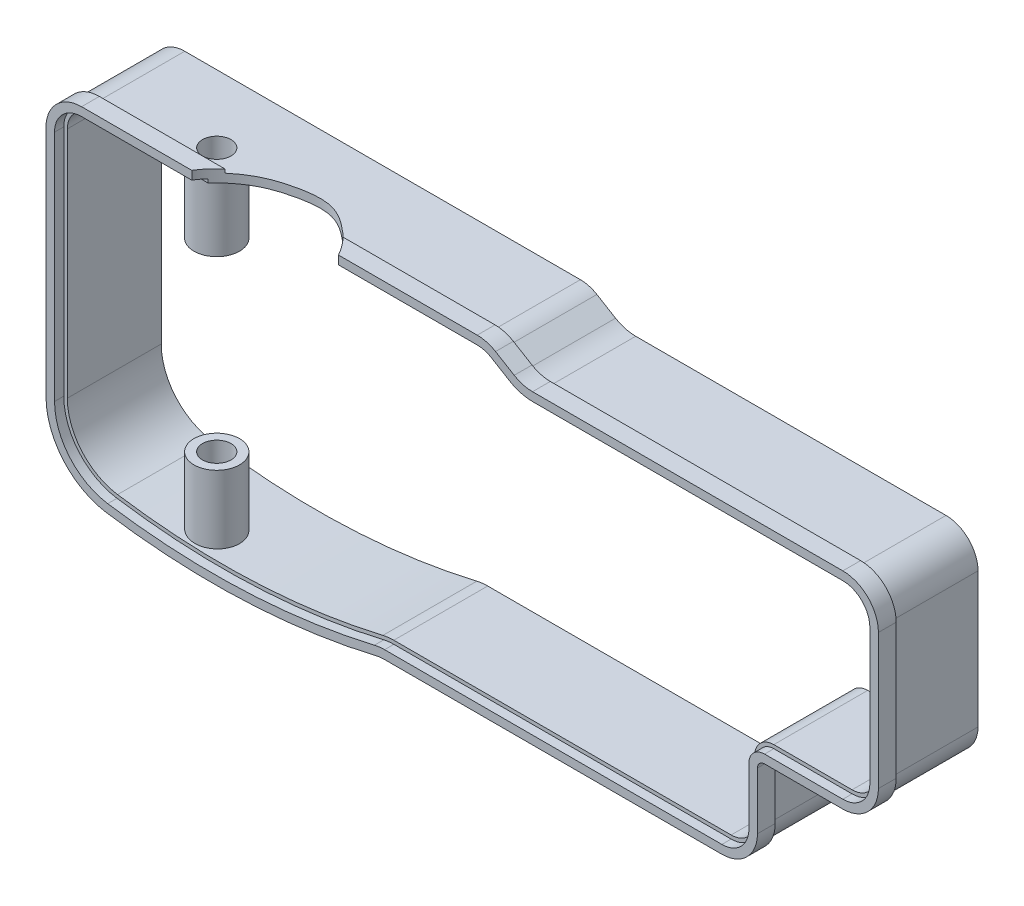
from build123d import *

# Parameters (mm, degrees)
EXTRUDE_1_DEPTH     = 2.5
FILLET_1_R          = 5
FILLET_2_R          = 10
FILLET_3_R          = 5
FILLET_4_R          = 1
EXTRUDE_2_DEPTH     = 12
SKETCH_3_R          = 2
CUT_EXTRUDE_1_DEPTH = 128.145329142
SHELL_1_T           = -1.2
CUT_EXTRUDE_2_DEPTH = 127.419500089
SKETCH_5_W          = 29.908945793
SKETCH_5_H          = 26
CUT_EXTRUDE_3_DEPTH = 12
CUT_EXTRUDE_4_DEPTH = 25
SKETCH_7_W          = 24.826968957
SKETCH_7_H          = 53.255380941
CUT_EXTRUDE_5_DEPTH = 140


with BuildPart() as part:
    # 草图1 → 凸台-拉伸1 (new body)
    with BuildSketch(Plane.XY):
        with BuildLine():
            Line((17, 0), (17, 14))
            Line((17, 14), (0, 14))
            Line((0, 14), (0, 43))
            Line((0, 43), (50, 43))
            Line((50, 43), (55, 46))
            Line((55, 46), (117, 46))
            Line((117, 46), (117, 43))
            Line((117, 43), (117, 0))
            ThreePointArc((117, 0), (93.5, -2.800462964), (70, 0))
            Line((70, 0), (17, 0))
        make_face()
    extrude(amount=EXTRUDE_1_DEPTH)

    # 圆角1
    fillet_1_edges = [part.edges().sort_by_distance(p)[0] for p in [
        (17, 0, 1.25),
        (0, 14, 1.25),
        (0, 43, 1.25),
        (117, 46, 1.25),
    ]]
    fillet(fillet_1_edges, radius=FILLET_1_R)

    # 圆角2
    fillet_2_edges = [part.edges().sort_by_distance(p)[0] for p in [
        (117, 0, 1.25),
    ]]
    fillet(fillet_2_edges, radius=FILLET_2_R)

    # 圆角3
    fillet_3_edges = [part.edges().sort_by_distance(p)[0] for p in [
        (70, 0, 1.25),
        (50, 43, 1.25),
        (55, 46, 1.25),
    ]]
    fillet(fillet_3_edges, radius=FILLET_3_R)

    # 圆角4
    fillet_4_edges = [part.edges().sort_by_distance(p)[0] for p in [
        (17, 14, 1.25),
    ]]
    fillet(fillet_4_edges, radius=FILLET_4_R)

    # 草图2 → 凸台-拉伸2 (add)
    with BuildSketch(Plane(origin=(0, 0, 0), x_dir=(-1, 0, 0), z_dir=(0, 0, -1))):
        with BuildLine():
            Line((-51.44480683, 43.283788909), (-54.069688925, 44.858718166))
            ThreePointArc((-54.069688925, 44.858718166), (-55.183718706, 45.336717177), (-56.384919825, 45.5))
            Line((-56.384919825, 45.5), (-112, 45.5))
            ThreePointArc((-112, 45.5), (-115.181980515, 44.181980515), (-116.5, 41))
            Line((-116.5, 41), (-116.5, 8.217797336))
            ThreePointArc((-116.5, 8.217797336), (-114.203731672, 2.024555051), (-108.425, -1.174719632))
            ThreePointArc((-108.425, -1.174719632), (-89.475956652, -2.219058182), (-70.673302226, 0.353309083))
            ThreePointArc((-70.673302226, 0.353309083), (-70.04666276, 0.463204186), (-69.411524962, 0.5))
            Line((-69.411524962, 0.5), (-22, 0.5))
            ThreePointArc((-22, 0.5), (-18.818019485, 1.818019485), (-17.5, 5))
            Line((-17.5, 5), (-17.5, 13))
            ThreePointArc((-17.5, 13), (-17.060660172, 14.060660172), (-16, 14.5))
            Line((-16, 14.5), (-5, 14.5))
            ThreePointArc((-5, 14.5), (-1.818019485, 15.818019485), (-0.5, 19))
            Line((-0.5, 19), (-0.5, 38))
            ThreePointArc((-0.5, 38), (-1.818019485, 41.181980515), (-5, 42.5))
            Line((-5, 42.5), (-48.615080175, 42.5))
            ThreePointArc((-48.615080175, 42.5), (-50.083214876, 42.699567895), (-51.44480683, 43.283788909))
        make_face()
    extrude(amount=EXTRUDE_2_DEPTH)

    # 草图3 → 切除-拉伸1 (cut, through all)
    with BuildSketch(Plane(origin=(0, 45.5, 0), x_dir=(1, 0, 0), z_dir=(0, 1, 0))):
        with Locations(Location((98, 2.5, 0), (0, 0, 270))):
            Circle(SKETCH_3_R)
    extrude(amount=-CUT_EXTRUDE_1_DEPTH, mode=Mode.SUBTRACT)

    # 抽壳1
    shell_1_openings = [part.faces().sort_by_distance(p)[0] for p in [
        (62.500022263, 22.701927877, -12),
    ]]
    offset(amount=SHELL_1_T, openings=shell_1_openings, kind=Kind.INTERSECTION)

    # 草图4 → 切除-拉伸2 (cut, through all)
    with BuildSketch(Plane(origin=(0, 0, 1.3), x_dir=(-1, 0, 0), z_dir=(0, 0, -1))):
        with BuildLine():
            Line((-56.384919825, 44.8), (-112, 44.8))
            ThreePointArc((-112, 44.8), (-114.687005769, 43.687005769), (-115.8, 41))
            Line((-115.8, 41), (-115.8, 8.217797336))
            ThreePointArc((-115.8, 8.217797336), (-113.672930391, 2.48089922), (-108.32, -0.482639434))
            ThreePointArc((-108.32, -0.482639434), (-89.504266505, -1.519630879), (-70.83389206, 1.03463933))
            ThreePointArc((-70.83389206, 1.03463933), (-70.12749848, 1.158521082), (-69.411524962, 1.2))
            Line((-69.411524962, 1.2), (-22, 1.2))
            ThreePointArc((-22, 1.2), (-19.312994231, 2.312994231), (-18.2, 5))
            Line((-18.2, 5), (-18.2, 13))
            ThreePointArc((-18.2, 13), (-17.555634919, 14.555634919), (-16, 15.2))
            Line((-16, 15.2), (-5, 15.2))
            ThreePointArc((-5, 15.2), (-2.312994231, 16.312994231), (-1.2, 19))
            Line((-1.2, 19), (-1.2, 38))
            ThreePointArc((-1.2, 38), (-2.312994231, 40.687005769), (-5, 41.8))
            Line((-5, 41.8), (-48.615080175, 41.8))
            ThreePointArc((-48.615080175, 41.8), (-50.270068383, 42.024967445), (-51.804953859, 42.683543861))
            Line((-51.804953859, 42.683543861), (-54.429835954, 44.258473118))
            ThreePointArc((-54.429835954, 44.258473118), (-55.370572214, 44.662116727), (-56.384919825, 44.8))
        make_face()
    extrude(amount=-CUT_EXTRUDE_2_DEPTH, mode=Mode.SUBTRACT)

    # 草图5 → 切除-拉伸3 (cut)
    with BuildSketch(Plane.XY.offset(2.5)):
        with Locations((94.149762403, 21.5)):
            Rectangle(SKETCH_5_W, SKETCH_5_H)
    extrude(amount=-CUT_EXTRUDE_3_DEPTH, mode=Mode.SUBTRACT)

    # 草图6 → 切除-拉伸4 (cut)
    with BuildSketch(Plane(origin=(0, 46, 0), x_dir=(1, 0, 0), z_dir=(0, 1, 0))):
        with BuildLine():
            add(Edge.make_bspline(
                [(96.996390033, -4.054230802), (96.985471859, -2.387863189), (93.231055265, 1.445134708), (88.130068901, 3.304325139), (82.90634874, 4.073922209), (79.327396591, 1.560107395), (76.925149921, -0.689014198), (71.094345742, -10.024640193), (97.032245655, -9.526634001), (96.996390033, -4.054230802)],
                knots=[0, 0, 0, 0, 0.1331942, 0.239246022, 0.354041302, 0.427365379, 0.493243552, 0.562586095, 1, 1, 1, 1], degree=3))
        make_face()
    extrude(amount=-CUT_EXTRUDE_4_DEPTH, mode=Mode.SUBTRACT)

    # 镜向1: part across plane


with BuildPart() as part_1:
    add(part.part)
    add(part.part.mirror(Plane(origin=(0, 14, 2.5), x_dir=(0, 0, 1), z_dir=(1, 0, 0))))

    # 草图7 → 切除-拉伸5 (cut)
    with BuildSketch(Plane.ZY):
        with Locations((-5.12662644, 20.756877597)):
            Rectangle(SKETCH_7_W, SKETCH_7_H)
    extrude(amount=-CUT_EXTRUDE_5_DEPTH, mode=Mode.SUBTRACT)


solid = part_1.part
